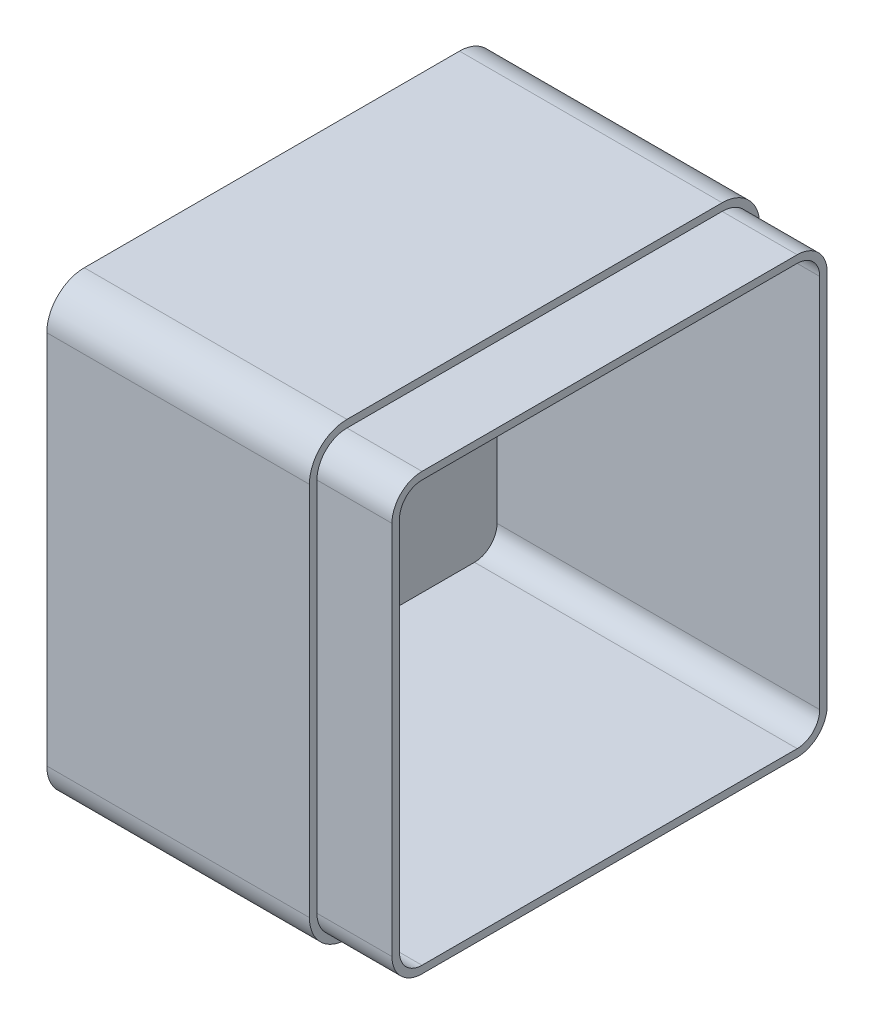
from build123d import *

# Parameters (mm, degrees)
SKIZZE1_W                       = 120
SKIZZE1_H                       = 120
AUFSATZ_LINEAR_AUSTRAGEN1_DEPTH = 90
VERRUNDUNG1_R                   = 10
WANDUNG1_T                      = -4
SCHNITT_LINEAR_AUSTRAGEN1_DEPTH = 20


with BuildPart() as part:
    # Skizze1 → Aufsatz-Linear austragen1 (new body)
    with BuildSketch(Plane.YZ):
        with Locations((60, 60)):
            Rectangle(SKIZZE1_W, SKIZZE1_H)
    extrude(amount=AUFSATZ_LINEAR_AUSTRAGEN1_DEPTH)

    # Verrundung1
    verrundung1_edges = [part.edges().sort_by_distance(p)[0] for p in [
        (45, 0, 120),
        (45, 120, 120),
        (45, 120, 0),
        (45, 0, 0),
    ]]
    fillet(verrundung1_edges, radius=VERRUNDUNG1_R)

    # Wandung1
    wandung1_openings = [part.faces().sort_by_distance(p)[0] for p in [
        (90, 60, 60),
    ]]
    offset(amount=WANDUNG1_T, openings=wandung1_openings, kind=Kind.INTERSECTION)

    # Skizze2 → Schnitt-Linear austragen1 (cut)
    with BuildSketch(Plane.YZ.offset(90)):
        with BuildLine():
            Line((10, 0), (110, 0))
            ThreePointArc((110, 0), (117.071067812, 2.928932188), (120, 10))
            Line((120, 10), (120, 110))
            ThreePointArc((120, 110), (117.071067812, 117.071067812), (110, 120))
            Line((110, 120), (10, 120))
            ThreePointArc((10, 120), (2.928932188, 117.071067812), (0, 110))
            Line((0, 110), (0, 10))
            ThreePointArc((0, 10), (2.928932188, 2.928932188), (10, 0))
        make_face()
        with BuildLine():
            Line((10, 2), (110, 2))
            ThreePointArc((110, 2), (115.656854249, 4.343145751), (118, 10))
            Line((118, 10), (118, 110))
            ThreePointArc((118, 110), (115.656854249, 115.656854249), (110, 118))
            Line((110, 118), (10, 118))
            ThreePointArc((10, 118), (4.343145751, 115.656854249), (2, 110))
            Line((2, 110), (2, 10))
            ThreePointArc((2, 10), (4.343145751, 4.343145751), (10, 2))
        make_face(mode=Mode.SUBTRACT)
    extrude(amount=-SCHNITT_LINEAR_AUSTRAGEN1_DEPTH, mode=Mode.SUBTRACT)


solid = part.part
